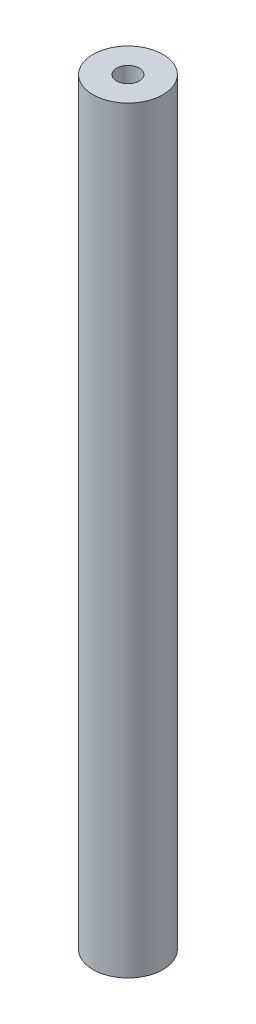
from build123d import *

# Parameters (mm, degrees)
SKETCH1_R           = 4.5
BOSS_EXTRUDE1_DEPTH = 97.5
SKETCH2_R           = 1.45
CUT_EXTRUDE1_DEPTH  = 97.5


with BuildPart() as part:
    # Sketch1 → Boss-Extrude1 (new body)
    with BuildSketch(Plane(origin=(0, 0, 0), x_dir=(1, 0, 0), z_dir=(0, 1, 0))):
        with Locations(Location((-6.553558128, 4.915168596, 0), (0, 0, 270))):
            Circle(SKETCH1_R)
    extrude(amount=BOSS_EXTRUDE1_DEPTH)

    # Sketch2 → Cut-Extrude1 (cut)
    with BuildSketch(Plane(origin=(0, 97.5, 0), x_dir=(1, 0, 0), z_dir=(0, 1, 0))):
        with Locations(Location((-6.553558128, 4.915168596, 0), (0, 0, 270))):
            Circle(SKETCH2_R)
    extrude(amount=-CUT_EXTRUDE1_DEPTH, mode=Mode.SUBTRACT)


solid = part.part
